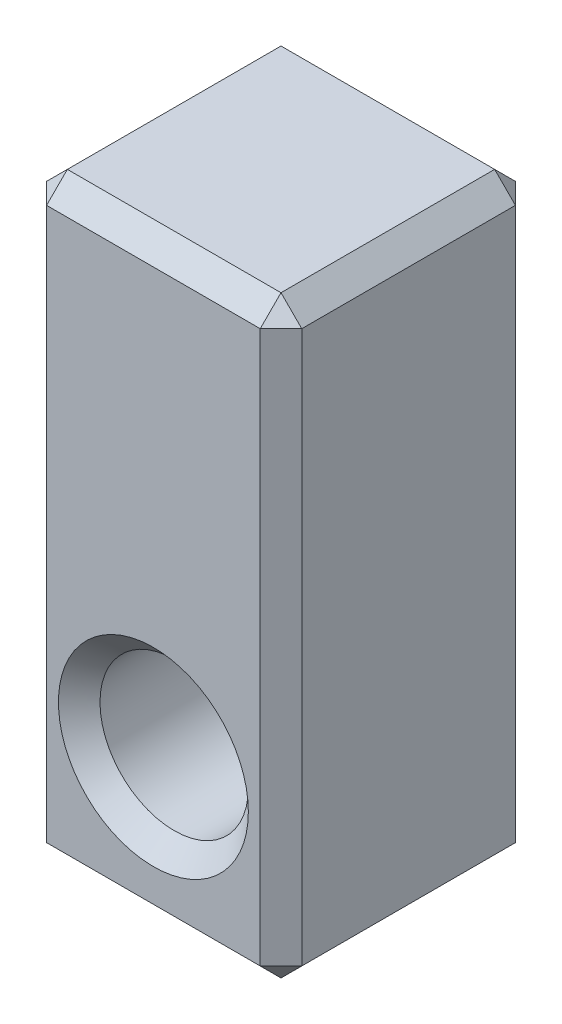
from build123d import *

# Parameters (mm, degrees)
SKETCH1_W           = 21.844
SKETCH1_H           = 21.844
BOSS_EXTRUDE1_DEPTH = 50.8
SKETCH3_R           = 6.35
CUT_EXTRUDE2_DEPTH  = 70.182669358
CHAMFER1_SIZE       = 1.778


with BuildPart() as part:
    # Sketch1 → Boss-Extrude1 (new body)
    with BuildSketch(Plane(origin=(0, 0, 0), x_dir=(1, 0, 0), z_dir=(0, 1, 0))):
        with Locations((-30.652528302, 10.384945755)):
            Rectangle(SKETCH1_W, SKETCH1_H)
    extrude(amount=BOSS_EXTRUDE1_DEPTH)

    # Sketch3 → Cut-Extrude2 (cut, through all)
    with BuildSketch(Plane.XY.offset(0.537054245)):
        with Locations((-30.652528302, 12.7)):
            Circle(SKETCH3_R)
    extrude(amount=-CUT_EXTRUDE2_DEPTH, mode=Mode.SUBTRACT)

    # Chamfer1
    chamfer1_edges = [part.edges().sort_by_distance(p)[0] for p in [
        (-30.652528302, 50.8, 0.537054245),
        (-37.002528302, 12.7, -21.306945755),
        (-37.002528302, 12.7, 0.537054245),
        (-19.730528302, 50.8, -10.384945755),
        (-30.652528302, 50.8, -21.306945755),
        (-19.730528302, 0, -10.384945755),
        (-30.652528302, 0, 0.537054245),
        (-41.574528302, 0, -10.384945755),
        (-30.652528302, 0, -21.306945755),
        (-19.730528302, 25.4, -21.306945755),
        (-19.730528302, 25.4, 0.537054245),
        (-41.574528302, 25.4, 0.537054245),
        (-41.574528302, 25.4, -21.306945755),
        (-41.574528302, 50.8, -10.384945755),
    ]]
    chamfer(chamfer1_edges, length=CHAMFER1_SIZE)


solid = part.part
